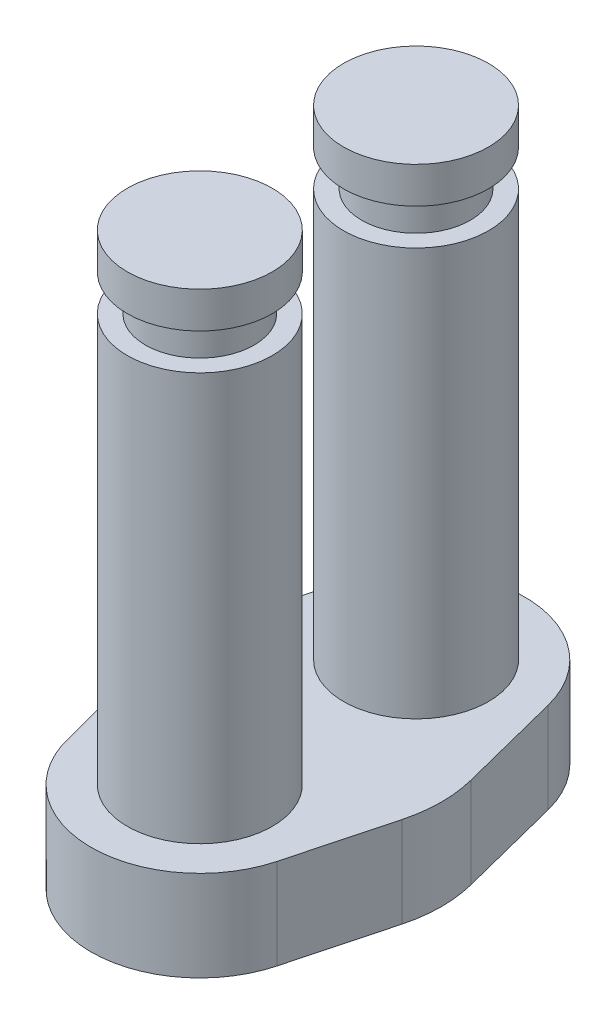
from build123d import *

# Parameters (mm, degrees)
BOSS_EXTRUDE2_DEPTH            = 5
SKETCH3_R                      = 4
BOSS_EXTRUDE3_DEPTH            = 22.5
SKETCH4_R                      = 3
BOSS_EXTRUDE4_DEPTH            = 2
SKETCH5_R                      = 4
BOSS_EXTRUDE5_DEPTH            = 2
SKETCH7_W                      = 1.89865
SKETCH7_H                      = 5
F_6_CLEARANCE_HOLE1_AT_2_COUNT = 2
F_6_CLEARANCE_HOLE1_AT_2_PITCH = 11.930689284


with BuildPart() as part:
    # Sketch2 → Boss-Extrude2 (new body)
    with BuildSketch(Plane(origin=(0, 0, 0), x_dir=(1, 0, 0), z_dir=(0, 1, 0))):
        with BuildLine():
            ThreePointArc((-1.921673483, -7.798539123), (3.967844549, -11.837003018), (9.548776015, -7.381801872))
            Line((9.548776015, -7.381801872), (10.998470019, -1.926053578))
            ThreePointArc((10.998470019, -1.926053578), (11.24988985, -0.04064778), (11.018921171, 1.84737246))
            Line((11.018921171, 1.84737246), (9.565136937, 7.567628243))
            ThreePointArc((9.565136937, 7.567628243), (3.75, 12.089730275), (-2.065136937, 7.567628243))
            Line((-2.065136937, 7.567628243), (-3.518921171, 1.84737246))
            ThreePointArc((-3.518921171, 1.84737246), (-3.749830525, -0.050419155), (-3.493426606, -1.944934706))
            Line((-3.493426606, -1.944934706), (-1.921673483, -7.798539123))
        make_face()
    extrude(amount=BOSS_EXTRUDE2_DEPTH)

    # Sketch3 → Boss-Extrude3 (add)
    with BuildSketch(Plane(origin=(0, 5, 0), x_dir=(1, 0, 0), z_dir=(0, 1, 0))):
        with Locations(Location((3.75, -5.840959009, 0), (0, 0, 90))):
            Circle(SKETCH3_R)
        with Locations(Location((3.75, 6.089730275, 0), (0, 0, 90))):
            Circle(SKETCH3_R)
    extrude(amount=BOSS_EXTRUDE3_DEPTH)

    # Sketch4 → Boss-Extrude4 (add)
    with BuildSketch(Plane(origin=(0, 27.5, 0), x_dir=(1, 0, 0), z_dir=(0, 1, 0))):
        with Locations(Location((3.75, -5.840959009, 0), (0, 0, 270))):
            Circle(SKETCH4_R)
        with Locations(Location((3.75, 6.089730275, 0), (0, 0, 270))):
            Circle(SKETCH4_R)
    extrude(amount=BOSS_EXTRUDE4_DEPTH)

    # Sketch5 → Boss-Extrude5 (add)
    with BuildSketch(Plane(origin=(0, 29.5, 0), x_dir=(1, 0, 0), z_dir=(0, 1, 0))):
        with Locations(Location((3.75, -5.840959009, 0), (0, 0, 90))):
            Circle(SKETCH5_R)
        with Locations(Location((3.75, 6.089730275, 0), (0, 0, 90))):
            Circle(SKETCH5_R)
    extrude(amount=BOSS_EXTRUDE5_DEPTH)

    # Sketch7 → #6 Clearance Hole1 (revolve, cut)
    with BuildSketch(Plane(origin=(3.75, 5, -6.089730275), x_dir=(0, 0, 1), z_dir=(1, 0, 0))):
        with Locations((0.949325, 2.5)):
            Rectangle(SKETCH7_W, SKETCH7_H)
    f_6_clearance_hole1 = revolve(axis=Axis((3.75, 11.35, -6.089730275), (0, -1, 0)), mode=Mode.SUBTRACT)

    # #6 Clearance Hole1 at 2: #6 Clearance Hole1 ×2
    with Locations(*[(0, 0, i * F_6_CLEARANCE_HOLE1_AT_2_PITCH) for i in range(1, F_6_CLEARANCE_HOLE1_AT_2_COUNT)]):
        add(f_6_clearance_hole1, mode=Mode.SUBTRACT)


solid = part.part
